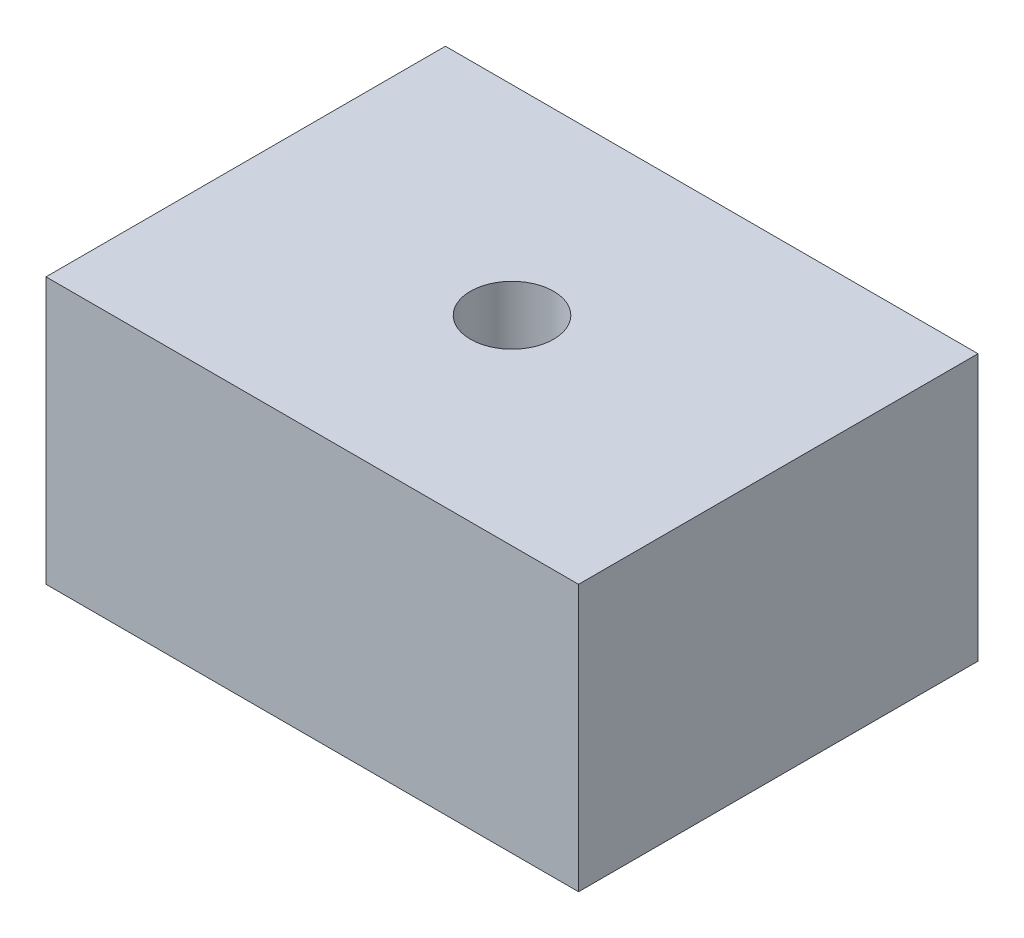
from build123d import *

# Parameters (mm, degrees)
SKETCH1_W               = 50.8
SKETCH1_H               = 38.1
BOSS_EXTRUDE1_DEPTH     = 25.4
F_3_8_16_TAPPED_HOLE1_D = 7.9375


with BuildPart() as part:
    # Sketch1 → Boss-Extrude1 (new body)
    with BuildSketch(Plane(origin=(0, 0, 0), x_dir=(1, 0, 0), z_dir=(0, 1, 0))):
        with Locations((-25.4, 19.05)):
            Rectangle(SKETCH1_W, SKETCH1_H)
    extrude(amount=BOSS_EXTRUDE1_DEPTH)

    # 3/8-16 Tapped Hole1 (through all)
    with Locations(Plane(origin=(0, 25.4, 0), x_dir=(1, 0, 0), z_dir=(0, 1, 0))):
        with Locations((-25.4, 19.05)):
            Hole(F_3_8_16_TAPPED_HOLE1_D / 2)


solid = part.part
